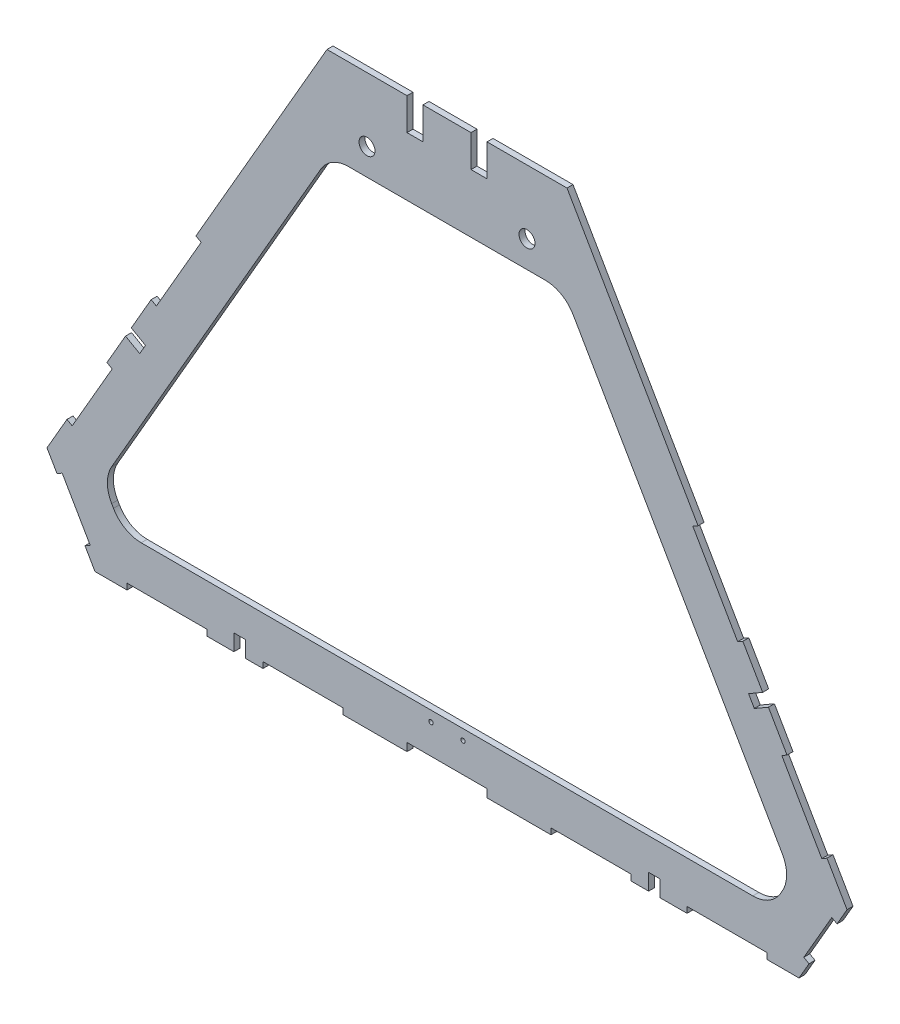
from build123d import *

# Parameters (mm, degrees)
BOSS_EXTRUDE2_DEPTH = 4.7625
CUT_EXTRUDE1_REACH  = 553.521
FILLET1_R           = 25.4
SKETCH3_W           = 63.5
SKETCH3_H           = 4.7625
SKETCH3_H_2         = 6.35
SKETCH3_W_2         = 12.7
SKETCH3_H_3         = 25.4
CUT_EXTRUDE2_DEPTH  = 552.520896165
SKETCH4_W           = 9.144
SKETCH4_H           = 12.954
SKETCH4_R           = 1.7145
SKETCH4_R_2         = 6.35
CUT_EXTRUDE3_DEPTH  = 552.520896165


with BuildPart() as part:
    # Sketch1 → Boss-Extrude2 (new body)
    with BuildSketch(Plane.XY):
        Polygon((-95.25, 450.939427751), (95.25, 450.939427751), (317.5, 65.991135768), (279.4, 0), (-279.4, 0), (-317.5, 65.991135768), align=None)
    extrude(amount=BOSS_EXTRUDE2_DEPTH)

    # Sketch2 → Cut-Extrude1 (cut, up to next)
    with BuildSketch(Plane.XY.offset(4.7625), mode=Mode.PRIVATE) as cut_extrude1_sk1:
        Polygon((-92.808632673, 378.968), (92.808632673, 378.968), (273.505909488, 65.991135768), (257.402954744, 38.1), (-257.402954744, 38.1), (-273.505909488, 65.991135768), align=None)
    cut_extrude1_tool1 = extrude(cut_extrude1_sk1.sketch, amount=-CUT_EXTRUDE1_REACH, mode=Mode.PRIVATE) & part.part
    add(cut_extrude1_tool1.solids().sort_by_distance((0, 180.212896, 4.7625))[0], mode=Mode.SUBTRACT)

    # Fillet1
    fillet1_edges = [part.edges().sort_by_distance(p)[0] for p in [
        (-273.505909488, 65.991135768, 2.38125),
        (-92.808632673, 378.968, 2.38125),
        (92.808632673, 378.968, 2.38125),
        (273.505909488, 65.991135768, 2.38125),
        (257.402954744, 38.1, 2.38125),
        (-257.402954744, 38.1, 2.38125),
    ]]
    fillet(fillet1_edges, radius=FILLET1_R)

    # Sketch3 → Cut-Extrude2 (cut, through all)
    with BuildSketch(Plane.XY.offset(4.7625)):
        with Locations((-222.25, 2.38125)):
            Rectangle(SKETCH3_W, SKETCH3_H)
        with Locations((-114.3, 2.38125)):
            Rectangle(SKETCH3_W, SKETCH3_H)
        with Locations((0, 3.175)):
            Rectangle(SKETCH3_W, SKETCH3_H_2)
        Polygon((-199.263, 270.783627103), (-195.138554014, 268.402377103), (-230.698554014, 206.810650386), (-234.823, 209.191900386), align=None)
        Polygon((-269.875, 148.480055479), (-265.750554014, 146.098805479), (-297.500554014, 91.106192339), (-301.625, 93.487442339), align=None)
        Polygon((-309.5625, 52.242982483), (-305.438054014, 54.624232483), (-283.213054014, 16.129403285), (-287.3375, 13.748153285), align=None)
        Polygon((287.3375, 13.748153285), (309.5625, 52.242982483), (305.438054014, 54.624232483), (283.213054014, 16.129403285), align=None)
        Polygon((301.625, 93.487442339), (269.875, 148.480055479), (265.750554014, 146.098805479), (297.500554014, 91.106192339), align=None)
        Polygon((234.823, 209.191900386), (199.263, 270.783627103), (195.138554014, 268.402377103), (230.698554014, 206.810650386), align=None)
        with Locations((114.3, 2.38125)):
            Rectangle(SKETCH3_W, SKETCH3_H)
        with Locations((222.25, 2.38125)):
            Rectangle(SKETCH3_W, SKETCH3_H)
        with Locations((-25.4, 438.239427751)):
            Rectangle(SKETCH3_W_2, SKETCH3_H_3)
        with Locations((25.4, 438.239427751)):
            Rectangle(SKETCH3_W_2, SKETCH3_H_3)
    extrude(amount=-CUT_EXTRUDE2_DEPTH, mode=Mode.SUBTRACT)

    # Sketch4 → Cut-Extrude3 (cut, through all)
    with BuildSketch(Plane.XY.offset(4.7625)):
        Polygon((-239.352506919, 175.438564268), (-250.571, 181.915564268), (-255.143, 173.996627976), (-243.924506919, 167.519627976), align=None)
        with Locations((-164.592, 6.477)):
            Rectangle(SKETCH4_W, SKETCH4_H)
        with Locations((164.592, 6.477)):
            Rectangle(SKETCH4_W, SKETCH4_H)
        Polygon((250.571, 181.915564268), (239.352506919, 175.438564268), (243.924506919, 167.519627976), (255.143, 173.996627976), align=None)
        with Locations((-12.7, 29.845)):
            Circle(SKETCH4_R)
        with Locations((12.7, 29.845)):
            Circle(SKETCH4_R)
        with Locations((63.5, 400.139427751)):
            Circle(SKETCH4_R_2)
        with Locations((-63.5, 400.139427751)):
            Circle(SKETCH4_R_2)
    extrude(amount=-CUT_EXTRUDE3_DEPTH, mode=Mode.SUBTRACT)


solid = part.part
